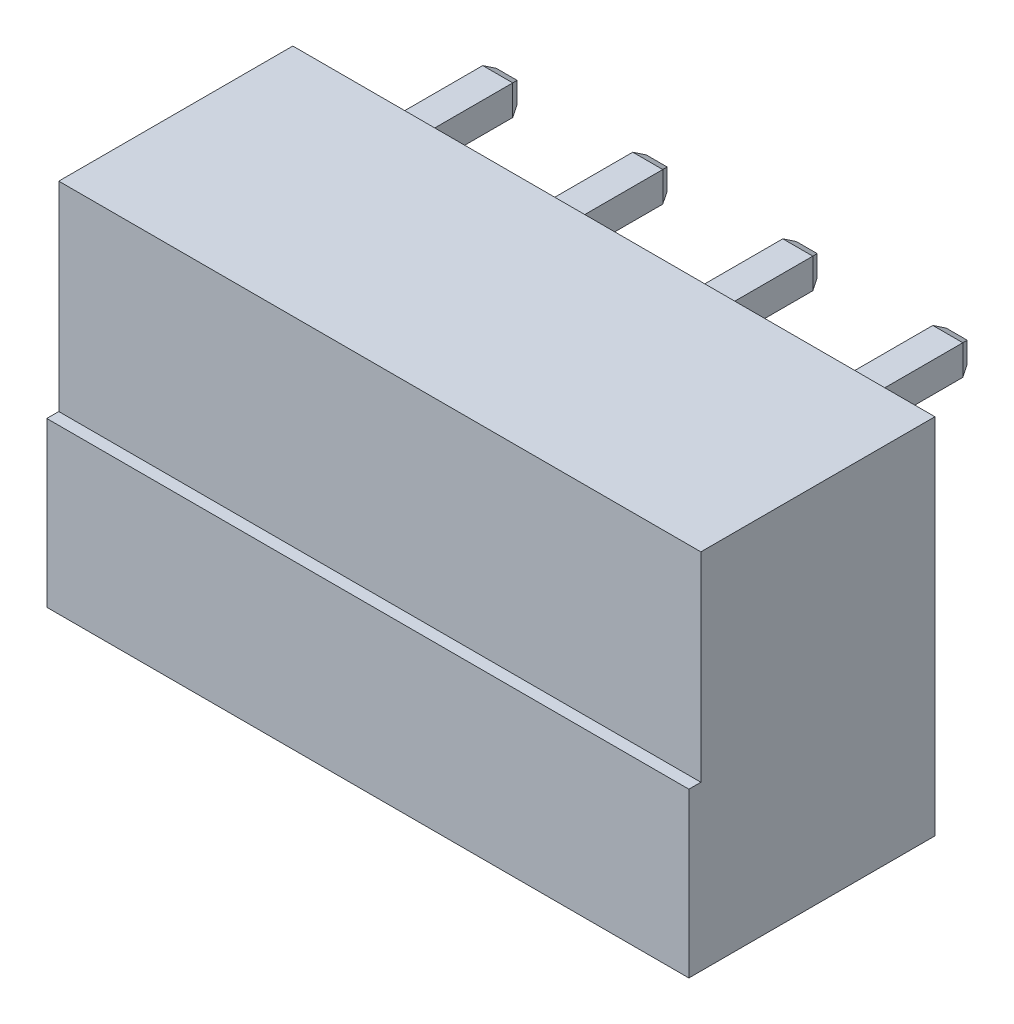
from build123d import *
from OCP.BRepFilletAPI import BRepFilletAPI_MakeChamfer

# Parameters (mm, degrees)
SKETCH_1_W                         = 21.4
SKETCH_1_H                         = 12.1
EXTRUDE_1_DEPTH                    = 8.2
CUT_EXTRUDE_1_DEPTH                = 8.66
SKETCH_3_R                         = 1.375
EXTRUDE_2_DEPTH                    = 2
CHAMFER_1_SIZE                     = 0.6
SKETCH_4_W                         = 21.4
SKETCH_4_H                         = 6.65
CUT_EXTRUDE_2_DEPTH                = 0.4
SKETCH_5_W                         = 1
SKETCH_5_H                         = 1
EXTRUDE_3_DEPTH                    = 4.26
CHAMFER_2_SIZE                     = 0.3
CHAMFER_2_SIZE2                    = 0.588783152
SKETCH_6_W                         = 1
SKETCH_6_H                         = 1
EXTRUDE_4_DEPTH                    = 4
CHAMFER_3_SIZE                     = 0.3
CHAMFER_3_SIZE2                    = 0.152857635
PATTERN_LINEAR_1_COUNT             = 4
PATTERN_LINEAR_1_PITCH             = 5
CHAMFER_1_OF_PATTERN_LINEAR_1_SIZE = 0.6
PATTERN_LINEAR_2_COUNT             = 4
PATTERN_LINEAR_2_PITCH             = 5


with BuildPart() as part:
    # Эскиз1 → Бобышка-Вытянуть1 (new body)
    with BuildSketch(Plane.XY):
        with Locations((0, 6.05)):
            Rectangle(SKETCH_1_W, SKETCH_1_H)
    extrude(amount=EXTRUDE_1_DEPTH)

    # Эскиз2 → Вырез-Вытянуть1 (cut)
    with BuildSketch(Plane.XZ):
        with BuildLine():
            Line((-10.07, 6.65), (-10.07, 1.7))
            Line((-10.07, 1.7), (-9.57, 1.7))
            ThreePointArc((-9.57, 1.7), (-7.57, 0.81), (-5.57, 1.7))
            Line((-5.57, 1.7), (-5.07, 1.7))
            Line((-5.07, 1.7), (-5.07, 6.65))
            Line((-5.07, 6.65), (-10.07, 6.65))
        make_face()
    cut_extrude_1 = extrude(amount=-CUT_EXTRUDE_1_DEPTH, mode=Mode.SUBTRACT)

    # Эскиз3 → Бобышка-Вытянуть2 (add)
    with BuildSketch(Plane.XZ.offset(-8.66)):
        with Locations(Location((-7.57, 4.1, 0), (0, 0, 180))):
            Circle(SKETCH_3_R)
    extrude_2 = extrude(amount=EXTRUDE_2_DEPTH)

    # Фаска1
    chamfer_1_edges = [part.edges().sort_by_distance(p)[0] for p in [
        (-6.195, 6.66, 4.1),
    ]]
    chamfer(chamfer_1_edges, length=CHAMFER_1_SIZE)

    # Эскиз4 → Вырез-Вытянуть2 (cut)
    with BuildSketch(Plane.XY.offset(8.2)):
        with Locations((0, 8.775)):
            Rectangle(SKETCH_4_W, SKETCH_4_H)
    extrude(amount=-CUT_EXTRUDE_2_DEPTH, mode=Mode.SUBTRACT)

    # Линейный массив1: Вырез-Вытянуть1, Бобышка-Вытянуть2 ×4
    with Locations(*[(i * PATTERN_LINEAR_1_PITCH, 0, 0) for i in range(1, PATTERN_LINEAR_1_COUNT)]):
        add(cut_extrude_1, mode=Mode.SUBTRACT)
        add(extrude_2)

    # Фаска1 of Линейный массив1
    chamfer_1_of_pattern_linear_1_edges = [part.edges().sort_by_distance(p)[0] for p in [
        (-1.195, 6.66, 4.1),
        (3.805, 6.66, 4.1),
        (8.805, 6.66, 4.1),
    ]]
    chamfer(chamfer_1_of_pattern_linear_1_edges, length=CHAMFER_1_OF_PATTERN_LINEAR_1_SIZE)


with BuildPart() as body_2:
    # Эскиз5 → Бобышка-Вытянуть3 (new body)
    with BuildSketch(Plane.XZ.offset(-6.66)):
        with Locations((-7.57, 4.1)):
            Rectangle(SKETCH_5_W, SKETCH_5_H)
    extrude(amount=EXTRUDE_3_DEPTH)

    # Фаска2
    chamfer_2_edges = [body_2.edges().sort_by_distance(p)[0] for p in [
        (-7.57, 2.4, 4.6),
        (-7.07, 2.4, 4.1),
        (-7.57, 2.4, 3.6),
        (-8.07, 2.4, 4.1),
    ]]
    chamfer_2_side = [body_2.faces().sort_by_distance(p)[0] for p in [
        (-7.57, 2.4, 4.1),
    ]]
    chamfer(chamfer_2_edges, length=CHAMFER_2_SIZE, length2=CHAMFER_2_SIZE2, reference=chamfer_2_side[0])


with BuildPart() as body_3:
    # Эскиз6 → Бобышка-Вытянуть4 (new body)
    with BuildSketch(Plane(origin=(0, 0, 0), x_dir=(-1, 0, 0), z_dir=(0, 0, -1))):
        with Locations((7.57, 10.5)):
            Rectangle(SKETCH_6_W, SKETCH_6_H)
    extrude(amount=EXTRUDE_4_DEPTH)

    # Фаска3: one chamfer whose edges measure the first distance from different faces: ONE call of the kernel's chamfer builder (chamfer() names one face for all edges)
    chamfer_3_edges_1 = [body_3.edges().sort_by_distance(p)[0] for p in [
        (-8.07, 10.5, -4),
    ]]
    chamfer_3_side_1 = [body_3.faces().sort_by_distance(p)[0] for p in [
        (-8.07, 10.5, -2),
    ]]
    chamfer_3_edges_2 = [body_3.edges().sort_by_distance(p)[0] for p in [
        (-7.57, 11, -4),
    ]]
    chamfer_3_side_2 = [body_3.faces().sort_by_distance(p)[0] for p in [
        (-7.57, 11, -2),
    ]]
    chamfer_3_edges_3 = [body_3.edges().sort_by_distance(p)[0] for p in [
        (-7.07, 10.5, -4),
    ]]
    chamfer_3_side_3 = [body_3.faces().sort_by_distance(p)[0] for p in [
        (-7.07, 10.5, -2),
    ]]
    chamfer_3_edges_4 = [body_3.edges().sort_by_distance(p)[0] for p in [
        (-7.57, 10, -4),
    ]]
    chamfer_3_side_4 = [body_3.faces().sort_by_distance(p)[0] for p in [
        (-7.57, 10, -2),
    ]]
    chamfer_3 = BRepFilletAPI_MakeChamfer(body_3.part.solid().wrapped)
    for e in chamfer_3_edges_1:
        chamfer_3.Add(CHAMFER_3_SIZE, CHAMFER_3_SIZE2, e.wrapped, chamfer_3_side_1[0].wrapped)  # the first distance lies on this face
    for e in chamfer_3_edges_2:
        chamfer_3.Add(CHAMFER_3_SIZE, CHAMFER_3_SIZE2, e.wrapped, chamfer_3_side_2[0].wrapped)  # the first distance lies on this face
    for e in chamfer_3_edges_3:
        chamfer_3.Add(CHAMFER_3_SIZE, CHAMFER_3_SIZE2, e.wrapped, chamfer_3_side_3[0].wrapped)  # the first distance lies on this face
    for e in chamfer_3_edges_4:
        chamfer_3.Add(CHAMFER_3_SIZE, CHAMFER_3_SIZE2, e.wrapped, chamfer_3_side_4[0].wrapped)  # the first distance lies on this face
    add(Compound.cast(chamfer_3.Shape()), mode=Mode.REPLACE)


with BuildPart() as pattern_linear_2_1:
    # Линейный массив2: pattern copy
    add(body_3.part.moved(Location(Vector(1, 0, 0) * (1 * PATTERN_LINEAR_2_PITCH))))


with BuildPart() as pattern_linear_2_2:
    # Линейный массив2: pattern copy
    add(body_3.part.moved(Location(Vector(1, 0, 0) * (2 * PATTERN_LINEAR_2_PITCH))))


with BuildPart() as pattern_linear_2_3:
    # Линейный массив2: pattern copy
    add(body_3.part.moved(Location(Vector(1, 0, 0) * (3 * PATTERN_LINEAR_2_PITCH))))


with BuildPart() as pattern_linear_2_4:
    # Линейный массив2: pattern copy
    add(body_2.part.moved(Location(Vector(1, 0, 0) * (1 * PATTERN_LINEAR_2_PITCH))))


with BuildPart() as pattern_linear_2_5:
    # Линейный массив2: pattern copy
    add(body_2.part.moved(Location(Vector(1, 0, 0) * (2 * PATTERN_LINEAR_2_PITCH))))


with BuildPart() as pattern_linear_2_6:
    # Линейный массив2: pattern copy
    add(body_2.part.moved(Location(Vector(1, 0, 0) * (3 * PATTERN_LINEAR_2_PITCH))))


solid = Compound([part.part, body_2.part, body_3.part, pattern_linear_2_1.part, pattern_linear_2_2.part, pattern_linear_2_3.part, pattern_linear_2_4.part, pattern_linear_2_5.part, pattern_linear_2_6.part])
